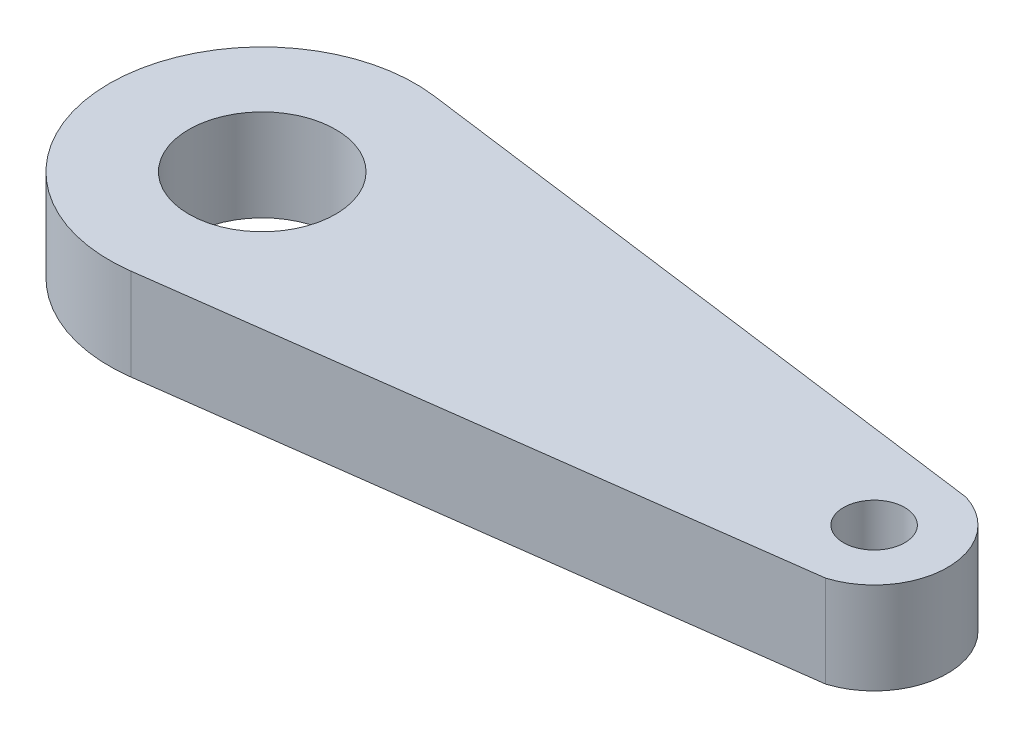
from build123d import *

# Parameters (mm, degrees)
SKETCH1_R           = 152.4
SKETCH1_R_2         = 63.5
BOSS_EXTRUDE1_DEPTH = 190.5


with BuildPart() as part:
    # Sketch1 → Boss-Extrude1 (new body)
    with BuildSketch(Plane(origin=(0, 0, 0), x_dir=(1, 0, 0), z_dir=(0, 1, 0))):
        with BuildLine():
            Line((657.371733042, 152.307316196), (-565.509397264, 314.735802206))
            ThreePointArc((-565.509397264, 314.735802206), (-924.814, 0), (-565.509397264, -314.735802206))
            Line((-565.509397264, -314.735802206), (657.371733042, -152.307316196))
            Line((657.371733042, -152.307316196), (707.57483155, -145.639118379))
            ThreePointArc((707.57483155, -145.639118379), (815.086, 0), (707.57483155, 145.639118379))
            Line((707.57483155, 145.639118379), (657.371733042, 152.307316196))
        make_face()
        with Locations(Location((-607.314, 0, 0), (0, 0, 270))):
            Circle(SKETCH1_R, mode=Mode.SUBTRACT)
        with Locations(Location((662.686, 0, 0), (0, 0, 270))):
            Circle(SKETCH1_R_2, mode=Mode.SUBTRACT)
    extrude(amount=BOSS_EXTRUDE1_DEPTH)


solid = part.part
